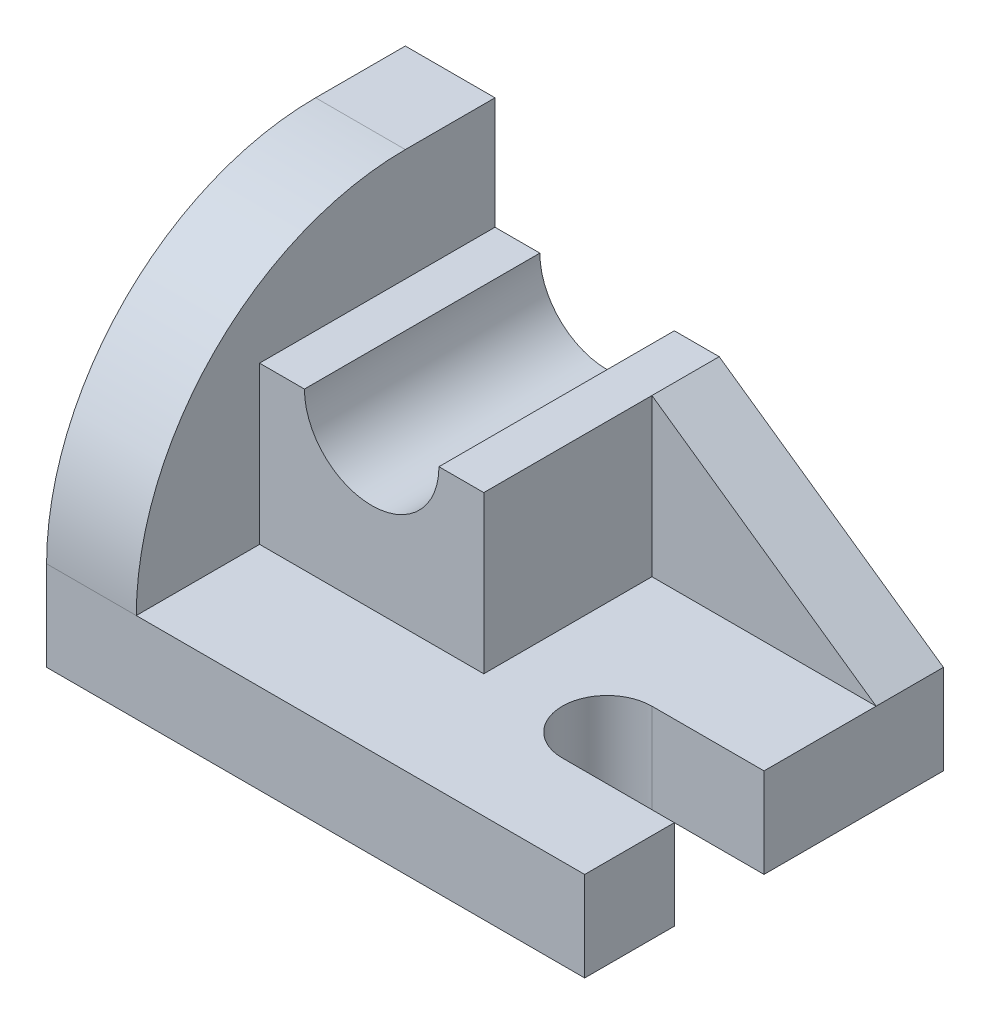
from build123d import *

# Parameters (mm, degrees)
BOSS_EXTRUDE1_DEPTH     = 42
BOSS_EXTRUDE2_DEPTH     = 64
BOSS_EXTRUDE3_DEPTH     = 12
BOSS_EXTRUDE4_DEPTH     = 16
BOSS_EXTRUDE5_START     = -20
BOSS_EXTRUDE5_DEPTH     = 16
CUT_EXTRUDE1_DEPTH      = 101
CUT_EXTRUDE1_DEPTH_BACK = 101


with BuildPart() as part:
    # Sketch2 → Boss-Extrude1 (new body)
    with BuildSketch(Plane.XY):
        with BuildLine():
            Line((-20, 28), (-20, 0))
            Line((-20, 0), (20, 0))
            Line((20, 0), (20, 28))
            Line((20, 28), (12, 28))
            ThreePointArc((12, 28), (0, 16), (-12, 28))
            Line((-12, 28), (-20, 28))
        make_face()
    extrude(amount=BOSS_EXTRUDE1_DEPTH)

    # Sketch2<3> → Boss-Extrude2 (add)
    with BuildSketch(Plane.XY):
        Polygon((20, 0), (-20, 0), (-36, 0), (-36, -16), (60, -16), (60, 0), align=None)
    extrude(amount=BOSS_EXTRUDE2_DEPTH)

    # Sketch2<4> → Boss-Extrude3 (add)
    with BuildSketch(Plane.XY):
        Polygon((20, 28), (20, 0), (60, 0), align=None)
    extrude(amount=BOSS_EXTRUDE3_DEPTH)

    # Sketch2<5> → Boss-Extrude4 (add)
    with BuildSketch(Plane.XY):
        Polygon((-36, 0), (-20, 0), (-20, 28), (-20, 48), (-36, 48), align=None)
    extrude(amount=BOSS_EXTRUDE4_DEPTH)

    # Sketch3 → Boss-Extrude5 (add)
    with BuildSketch(Plane(origin=(0, 0, 0), x_dir=(0, 0, -1), z_dir=(1, 0, 0)).offset(BOSS_EXTRUDE5_START)):
        with BuildLine():
            Line((-64, 0), (-16, 0))
            Line((-16, 0), (-16, 48))
            ThreePointArc((-16, 48), (-49.941125497, 33.941125497), (-64, 0))
        make_face()
    extrude(amount=-BOSS_EXTRUDE5_DEPTH)

    # Sketch4 → Cut-Extrude1 (cut, two sides: drawn at the far end of the back side and taken through both)
    with BuildSketch(Plane(origin=(0, 0, 0), x_dir=(1, 0, 0), z_dir=(0, 1, 0)).offset(-CUT_EXTRUDE1_DEPTH_BACK)):
        with BuildLine():
            Line((60, -48), (60, -32))
            Line((60, -32), (40, -32))
            ThreePointArc((40, -32), (32, -40), (40, -48))
            Line((40, -48), (60, -48))
        make_face()
    extrude(amount=CUT_EXTRUDE1_DEPTH + CUT_EXTRUDE1_DEPTH_BACK, mode=Mode.SUBTRACT)


solid = part.part
